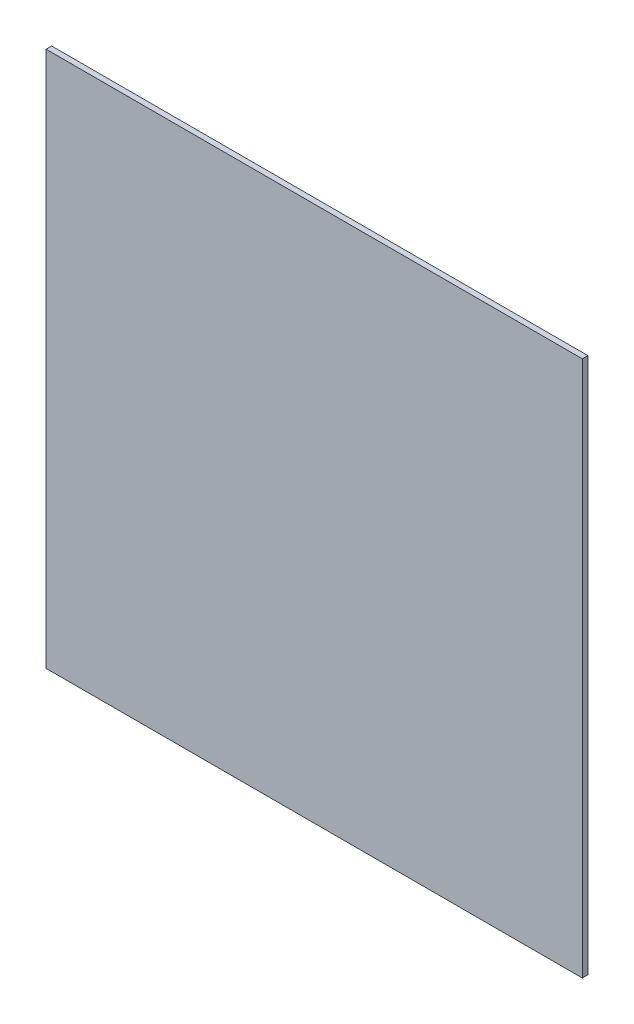
from build123d import *

# Parameters (mm, degrees)
SKETCH1_W           = 914.4
SKETCH1_H           = 914.4
BOSS_EXTRUDE1_DEPTH = 9.525


with BuildPart() as part:
    # Sketch1 → Boss-Extrude1 (new body)
    with BuildSketch(Plane.XY):
        with Locations((-457.2, -4731.8)):
            Rectangle(SKETCH1_W, SKETCH1_H)
    extrude(amount=BOSS_EXTRUDE1_DEPTH)


solid = part.part
